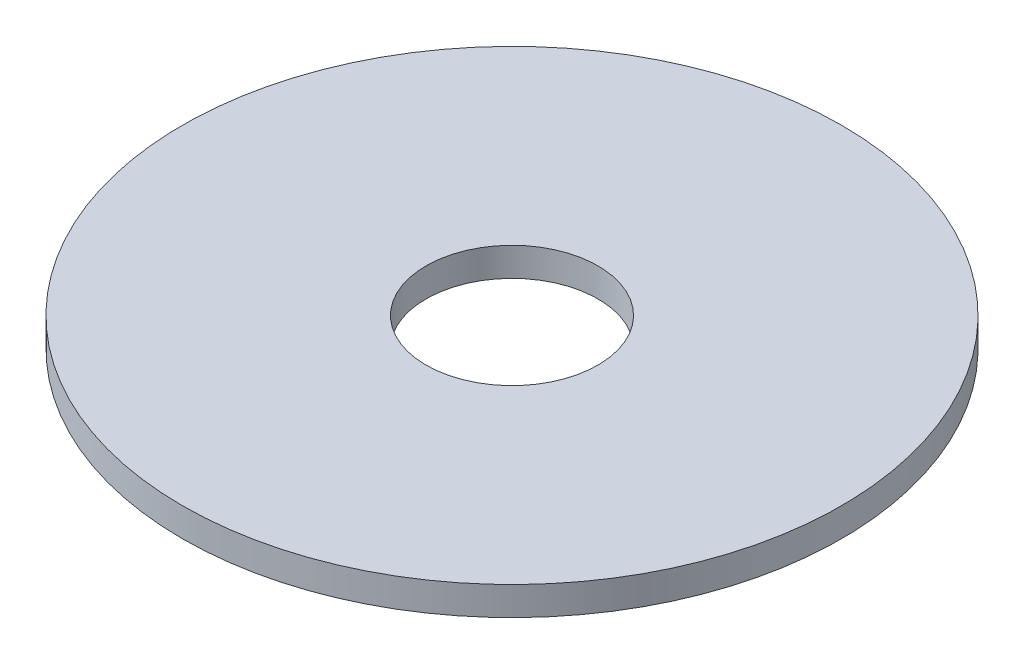
from build123d import *

# Parameters (mm, degrees)
SKETCH1_R           = 14.605
SKETCH1_R_2         = 3.81
BOSS_EXTRUDE1_DEPTH = 1.27


with BuildPart() as part:
    # Sketch1 → Boss-Extrude1 (new body)
    with BuildSketch(Plane(origin=(0, 0, 0), x_dir=(1, 0, 0), z_dir=(0, 1, 0))):
        with Locations(Location((0, 0, 0), (0, 0, 270))):
            Circle(SKETCH1_R)
        with Locations(Location((0, 0, 0), (0, 0, 270))):
            Circle(SKETCH1_R_2, mode=Mode.SUBTRACT)
    extrude(amount=BOSS_EXTRUDE1_DEPTH)


solid = part.part
